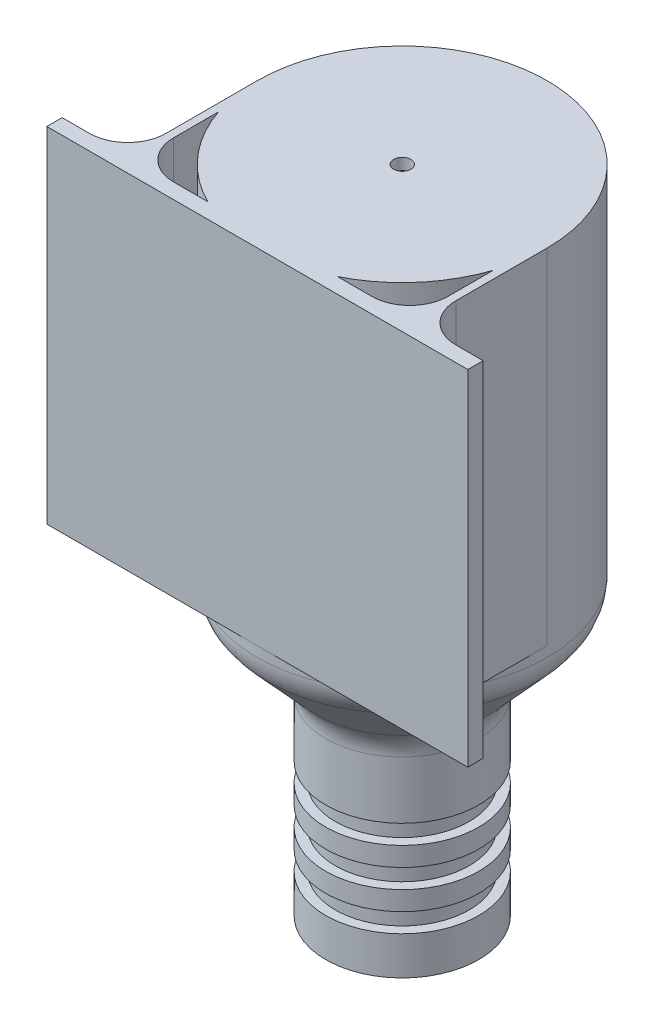
from build123d import *

# Parameters (mm, degrees)
EXTRUDE_1_DEPTH = 90
EXTRUDE_START   = -3
EXTRUDE_2_DEPTH = 3


with BuildPart() as part:
    # 草图2 → 旋转1 (revolve)
    with BuildSketch(Plane.XY, mode=Mode.PRIVATE) as revolve_1_sk:
        with BuildLine():
            Line((20, -224.411230387), (20, -214.411230387))
            Line((20, -214.411230387), (17.5, -214.411230387))
            Line((17.5, -214.411230387), (17.5, -209.411230387))
            Line((17.5, -209.411230387), (20, -209.411230387))
            Line((20, -209.411230387), (20, -204.411230387))
            Line((20, -204.411230387), (17.5, -204.411230387))
            Line((17.5, -204.411230387), (17.5, -199.411230387))
            Line((17.5, -199.411230387), (20, -199.411230387))
            Line((20, -199.411230387), (20, -194.411230387))
            Line((20, -194.411230387), (17.5, -194.411230387))
            Line((17.5, -194.411230387), (17.5, -189.411230387))
            Line((17.5, -189.411230387), (20, -189.411230387))
            Line((20, -189.411230387), (20, -174.411230387))
            ThreePointArc((20, -174.411230387), (20.676631798, -170.795320354), (22.614961073, -167.668738262))
            Line((22.614961073, -167.668738262), (35.258140309, -153.820687856))
            ThreePointArc((35.258140309, -153.820687856), (37.196469585, -150.694105764), (37.873101383, -147.078195731))
            Line((37.873101383, -147.078195731), (37.873101383, -54.411230387))
            Line((37.873101383, -54.411230387), (35.873101383, -54.411230387))
            Line((35.873101383, -54.411230387), (35.873101383, -129.659355933))
            ThreePointArc((35.873101383, -129.659355933), (31.874010536, -149.253139566), (20.5164471, -165.712630368))
            Line((20.5164471, -165.712630368), (18.571330856, -167.581679311))
            ThreePointArc((18.571330856, -167.581679311), (16.299818169, -170.873577472), (15.5, -174.792334198))
            Line((15.5, -174.792334198), (15.5, -224.411230387))
            Line((15.5, -224.411230387), (20, -224.411230387))
        make_face()
    revolve(revolve_1_sk.sketch.rotate(Axis((0, -59.896764436, 0), (0, -1, 0)), 180), axis=Axis((0, -59.896764436, 0), (0, -1, 0)))

    # 草图4 → 凸台-拉伸1 (add)
    with BuildSketch(Plane(origin=(0, -54.411230387, 0), x_dir=(1, 0, 0), z_dir=(0, 1, 0))):
        with BuildLine():
            ThreePointArc((-35.873101383, -12.144645138), (-37.369756581, -6.154112558), (-37.873101383, 0))
            Line((-37.873101383, 0), (-37.873101383, -23.873101383))
            ThreePointArc((-37.873101383, -23.873101383), (-40.802033571, -30.944169195), (-47.873101383, -33.873101383))
            Line((-47.873101383, -33.873101383), (-55, -33.873101383))
            Line((-55, -33.873101383), (-55, -37.873101383))
            Line((-55, -37.873101383), (0, -37.873101383))
            ThreePointArc((0, -37.873101383), (-8.703229445, -36.859538868), (-16.940626053, -33.873101383))
            Line((-16.940626053, -33.873101383), (-25.873101383, -33.873101383))
            ThreePointArc((-25.873101383, -33.873101383), (-32.944169195, -30.944169195), (-35.873101383, -23.873101383))
            Line((-35.873101383, -23.873101383), (-35.873101383, -12.144645138))
        make_face()
        with BuildLine():
            Line((37.873101383, -23.873101383), (37.873101383, 0))
            ThreePointArc((37.873101383, 0), (37.369756581, -6.154112558), (35.873101383, -12.144645138))
            Line((35.873101383, -12.144645138), (35.873101383, -23.873101383))
            ThreePointArc((35.873101383, -23.873101383), (32.944169195, -30.944169195), (25.873101383, -33.873101383))
            Line((25.873101383, -33.873101383), (16.940626053, -33.873101383))
            ThreePointArc((16.940626053, -33.873101383), (8.703229445, -36.859538868), (0, -37.873101383))
            Line((0, -37.873101383), (55, -37.873101383))
            Line((55, -37.873101383), (55, -33.873101383))
            Line((55, -33.873101383), (47.873101383, -33.873101383))
            ThreePointArc((47.873101383, -33.873101383), (40.802033571, -30.944169195), (37.873101383, -23.873101383))
        make_face()
        with BuildLine():
            ThreePointArc((0, -35.873101383), (-5.98941578, -35.369567448), (-11.810690307, -33.873101383))
            Line((-11.810690307, -33.873101383), (-16.940626053, -33.873101383))
            ThreePointArc((-16.940626053, -33.873101383), (-8.703229445, -36.859538868), (0, -37.873101383))
            Line((0, -37.873101383), (0, -35.873101383))
        make_face()
        with BuildLine():
            Line((16.940626053, -33.873101383), (11.810690307, -33.873101383))
            ThreePointArc((11.810690307, -33.873101383), (5.98941578, -35.369567448), (0, -35.873101383))
            Line((0, -35.873101383), (0, -37.873101383))
            ThreePointArc((0, -37.873101383), (8.703229445, -36.859538868), (16.940626053, -33.873101383))
        make_face()
    extrude(amount=-EXTRUDE_1_DEPTH)

    # 草图3 → 凸台-拉伸2 (add)
    with BuildSketch(Plane(origin=(0, -54.411230387, 0), x_dir=(1, 0, 0), z_dir=(0, 1, 0)).offset(EXTRUDE_START)):
        with BuildLine():
            ThreePointArc((35.873101383, 0), (25.36611325, 25.36611325), (0, 35.873101383))
            Line((0, 35.873101383), (0, 2.25))
            ThreePointArc((0, 2.25), (1.590990258, 1.590990258), (2.25, 0))
            ThreePointArc((2.25, 0), (1.590990258, -1.590990258), (0, -2.25))
            Line((0, -2.25), (0, -35.873101383))
            ThreePointArc((0, -35.873101383), (25.36611325, -25.36611325), (35.873101383, 0))
        make_face()
        with BuildLine():
            Line((0, 2.25), (0, 35.873101383))
            ThreePointArc((0, 35.873101383), (-35.873101383, 0), (0, -35.873101383))
            Line((0, -35.873101383), (0, -2.25))
            ThreePointArc((0, -2.25), (-2.25, 0), (0, 2.25))
        make_face()
        with BuildLine():
            ThreePointArc((37.873101383, 0), (26.780326812, 26.780326812), (0, 37.873101383))
            Line((0, 37.873101383), (0, 35.873101383))
            ThreePointArc((0, 35.873101383), (25.36611325, 25.36611325), (35.873101383, 0))
            ThreePointArc((35.873101383, 0), (25.36611325, -25.36611325), (0, -35.873101383))
            Line((0, -35.873101383), (0, -37.873101383))
            ThreePointArc((0, -37.873101383), (26.780326812, -26.780326812), (37.873101383, 0))
        make_face()
        with BuildLine():
            Line((0, 35.873101383), (0, 37.873101383))
            ThreePointArc((0, 37.873101383), (-37.873101383, 0), (0, -37.873101383))
            Line((0, -37.873101383), (0, -35.873101383))
            ThreePointArc((0, -35.873101383), (-35.873101383, 0), (0, 35.873101383))
        make_face()
    extrude(amount=EXTRUDE_2_DEPTH)


solid = part.part
